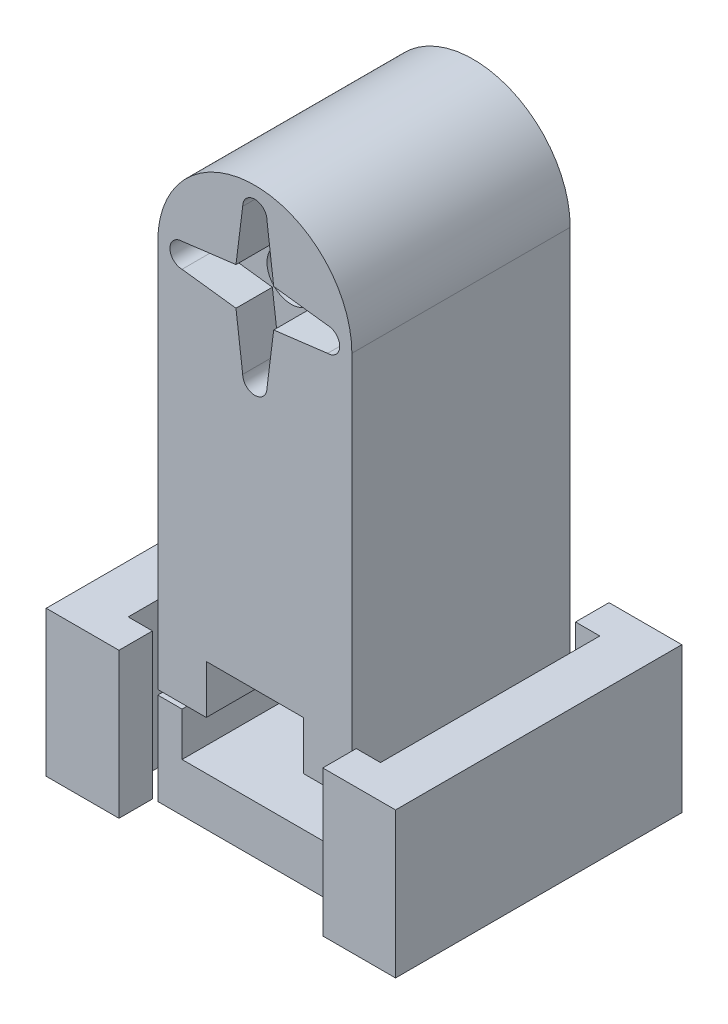
from build123d import *

# Parameters (mm, degrees)
SALIENTE_EXTRUIR1_DEPTH = 45
CORTAR_EXTRUIR1_DEPTH   = 7.5
CROQUIS3_R              = 5
CORTAR_EXTRUIR2_DEPTH   = 57.5
CROQUIS4_W              = 41.868476083
CROQUIS4_H              = 21.001033166
CORTAR_EXTRUIR3_DEPTH   = 57.5
CORTAR_EXTRUIR4_START   = -2.5
CORTAR_EXTRUIR4_DEPTH   = 40
CORTAR_EXTRUIR5_DEPTH   = 45
CORTAR_EXTRUIR7_START   = -40
CROQUIS7_W              = 20
CROQUIS7_H              = 10
CORTAR_EXTRUIR7_DEPTH   = 20
SALIENTE_EXTRUIR2_DEPTH = 45
CROQUIS9_W              = 5
CROQUIS9_H              = 10
CORTAR_EXTRUIR8_DEPTH   = 45
CROQUIS10_R             = 3
CORTAR_EXTRUIR9_DEPTH   = 20
CROQUIS11_W             = 40
CROQUIS11_H             = 1
CORTAR_EXTRUIR12_DEPTH  = 45
CROQUIS12_W             = 5
CROQUIS12_H             = 30
SALIENTE_EXTRUIR3_DEPTH = 7
CROQUIS13_W             = 30
CROQUIS13_H             = 52
SALIENTE_EXTRUIR4_DEPTH = 16
CROQUIS14_W             = 30
CROQUIS14_H             = 52
SALIENTE_EXTRUIR5_DEPTH = 16
CROQUIS15_W             = 6
CROQUIS15_H             = 30
CORTAR_EXTRUIR13_DEPTH  = 7
CROQUIS16_W             = 6
CROQUIS16_H             = 30
CORTAR_EXTRUIR14_DEPTH  = 7
CROQUIS17_W             = 1
CROQUIS17_H             = 30
CORTAR_EXTRUIR15_DEPTH  = 45
CROQUIS18_W             = 15
CROQUIS18_H             = 30
SALIENTE_EXTRUIR6_DEPTH = 7
CORTAR_EXTRUIR16_START  = -6.9
CROQUIS19_W             = 5
CROQUIS19_H             = 30
CORTAR_EXTRUIR16_DEPTH  = 45.2
CORTAR_EXTRUIR17_START  = -6.9
CROQUIS20_W             = 5
CROQUIS20_H             = 30
CORTAR_EXTRUIR17_DEPTH  = 45.2


with BuildPart() as part:
    # Croquis1 → Saliente-Extruir1 (new body)
    with BuildSketch(Plane(origin=(0, 0, 0), x_dir=(0, 1, 0), z_dir=(0, 0, 1))):
        with BuildLine():
            Line((0, 20), (40, 20))
            ThreePointArc((40, 20), (60, 0), (40, -20))
            Line((40, -20), (0, -20))
            Line((0, -20), (-40, -20))
            ThreePointArc((-40, -20), (-60, 0), (-40, 20))
            Line((-40, 20), (0, 20))
        make_face()
    extrude(amount=SALIENTE_EXTRUIR1_DEPTH)

    # Croquis2 → Cortar-Extruir1 (cut)
    with BuildSketch(Plane.XY.offset(45)):
        with BuildLine():
            Line((-15, 42.5), (-3.889087297, 43.889087297))
            Line((-3.889087297, 43.889087297), (-2.5, 55))
            ThreePointArc((-2.5, 55), (0, 57.5), (2.5, 55))
            Line((2.5, 55), (3.889087297, 43.889087297))
            Line((3.889087297, 43.889087297), (15, 42.5))
            ThreePointArc((15, 42.5), (17.5, 40), (15, 37.5))
            Line((15, 37.5), (3.889087297, 36.110912703))
            Line((3.889087297, 36.110912703), (2.5, 25))
            ThreePointArc((2.5, 25), (0, 22.5), (-2.5, 25))
            Line((-2.5, 25), (-3.889087297, 36.110912703))
            Line((-3.889087297, 36.110912703), (-15, 37.5))
            ThreePointArc((-15, 37.5), (-17.5, 40), (-15, 42.5))
        make_face()
    extrude(amount=-CORTAR_EXTRUIR1_DEPTH, mode=Mode.SUBTRACT)

    # Croquis3 → Cortar-Extruir2 (cut)
    with BuildSketch(Plane.XY.offset(45)):
        with Locations((0, 40)):
            Circle(CROQUIS3_R)
    extrude(amount=-CORTAR_EXTRUIR2_DEPTH, mode=Mode.SUBTRACT)

    # Croquis4 → Cortar-Extruir3 (cut)
    with BuildSketch(Plane.XY.offset(45)):
        with Locations((-0.934238042, -50.500516583)):
            Rectangle(CROQUIS4_W, CROQUIS4_H)
    extrude(amount=-CORTAR_EXTRUIR3_DEPTH, mode=Mode.SUBTRACT)

    # Croquis5 → Cortar-Extruir4 (cut)
    with BuildSketch(Plane.XY.offset(45).offset(CORTAR_EXTRUIR4_START)):
        Polygon((0, -40), (10, -40), (10, 0), (-10, 0), (-10, -40), align=None)
    extrude(amount=-CORTAR_EXTRUIR4_DEPTH, mode=Mode.SUBTRACT)

    # Croquis6 → Cortar-Extruir5 (cut)
    with BuildSketch(Plane.XY.offset(45)):
        Polygon((0, -40), (-10, -40), (-10, -30), (10, -30), (10, -40), align=None)
    extrude(amount=-CORTAR_EXTRUIR5_DEPTH, mode=Mode.SUBTRACT)

    # Croquis7 → Cortar-Extruir7 (cut)
    with BuildSketch(Plane.XY.offset(45).offset(CORTAR_EXTRUIR7_START)):
        with Locations((0, -5)):
            Rectangle(CROQUIS7_W, CROQUIS7_H)
    extrude(amount=-CORTAR_EXTRUIR7_DEPTH, mode=Mode.SUBTRACT)

    # Croquis8 → Saliente-Extruir2 (add)
    with BuildSketch(Plane(origin=(0, 0, 0), x_dir=(1, 0, 0), z_dir=(0, 0, -1))):
        Polygon((10, 50), (10, 40), (20, 40), (20, 60), (-20, 60), (-20, 40), (-10, 40), (-10, 50), align=None)
    extrude(amount=-SALIENTE_EXTRUIR2_DEPTH)

    # Croquis9 → Cortar-Extruir8 (cut)
    with BuildSketch(Plane(origin=(0, 0, 0), x_dir=(-1, 0, 0), z_dir=(0, 0, -1))):
        with Locations((-12.5, -45)):
            Rectangle(CROQUIS9_W, CROQUIS9_H)
        with Locations((12.5, -45)):
            Rectangle(CROQUIS9_W, CROQUIS9_H)
    extrude(amount=-CORTAR_EXTRUIR8_DEPTH, mode=Mode.SUBTRACT)

    # Croquis10 → Cortar-Extruir9 (cut)
    with BuildSketch(Plane.XZ.offset(60)):
        with Locations(Location((0, 12.5, 0), (0, 0, 270))):
            Circle(CROQUIS10_R)
    extrude(amount=-CORTAR_EXTRUIR9_DEPTH, mode=Mode.SUBTRACT)

    # Croquis11 → Cortar-Extruir12 (cut)
    with BuildSketch(Plane(origin=(0, 0, 0), x_dir=(1, 0, 0), z_dir=(0, 0, -1))):
        with Locations((0, 40.5)):
            Rectangle(CROQUIS11_W, CROQUIS11_H)
    extrude(amount=-CORTAR_EXTRUIR12_DEPTH, mode=Mode.SUBTRACT)


with BuildPart() as cortar_extruir12_piece_1:
    # of the separate pieces the step leaves, piece 1, a body of its own (cortar_extruir12_pieces)
    add(part.part.solids().sort_by_distance((-20, 40, 0))[0])



with BuildPart() as cortar_extruir12_piece_2:
    # of the separate pieces the step leaves, piece 2, a body of its own (cortar_extruir12_pieces)
    add(part.part.solids().sort_by_distance((-20, -41, 0))[0])


with BuildPart() as cortar_extruir12_piece_1_1:
    add(cortar_extruir12_piece_1.part)

    add(cortar_extruir12_piece_2.part)  # Saliente-Extruir3 merges Cortar-Extruir12 piece 2
    # Croquis12 → Saliente-Extruir3 (add)
    with BuildSketch(Plane.XY.offset(45)):
        with Locations((-17.5, -45)):
            Rectangle(CROQUIS12_W, CROQUIS12_H)
        with Locations((17.5, -45)):
            Rectangle(CROQUIS12_W, CROQUIS12_H)
    extrude(amount=SALIENTE_EXTRUIR3_DEPTH)

    # Croquis13 → Saliente-Extruir4 (add)
    with BuildSketch(Plane.YZ.offset(20)):
        with Locations((-45, 26)):
            Rectangle(CROQUIS13_W, CROQUIS13_H)
    extrude(amount=SALIENTE_EXTRUIR4_DEPTH)

    # Croquis14 → Saliente-Extruir5 (add)
    with BuildSketch(Plane(origin=(-20, 0, 0), x_dir=(0, -1, 0), z_dir=(-1, 0, 0))):
        with Locations((45, 26)):
            Rectangle(CROQUIS14_W, CROQUIS14_H)
    extrude(amount=SALIENTE_EXTRUIR5_DEPTH)

    # Croquis15 → Cortar-Extruir13 (cut)
    with BuildSketch(Plane.XY.offset(52)):
        with Locations((18, -45)):
            Rectangle(CROQUIS15_W, CROQUIS15_H)
    extrude(amount=-CORTAR_EXTRUIR13_DEPTH, mode=Mode.SUBTRACT)

    # Croquis16 → Cortar-Extruir14 (cut)
    with BuildSketch(Plane.XY.offset(52)):
        with Locations((-18, -45)):
            Rectangle(CROQUIS16_W, CROQUIS16_H)
    extrude(amount=-CORTAR_EXTRUIR14_DEPTH, mode=Mode.SUBTRACT)

    # Croquis17 → Cortar-Extruir15 (cut)
    with BuildSketch(Plane.XY.offset(45)):
        with Locations((20.5, -45)):
            Rectangle(CROQUIS17_W, CROQUIS17_H)
        with Locations((-20.5, -45)):
            Rectangle(CROQUIS17_W, CROQUIS17_H)
    extrude(amount=-CORTAR_EXTRUIR15_DEPTH, mode=Mode.SUBTRACT)


with BuildPart() as cortar_extruir15_piece_1:
    # of the separate pieces the step leaves, piece 1, a body of its own (cortar_extruir15_pieces)
    add(cortar_extruir12_piece_1_1.part.solids().sort_by_distance((-20, 40, 0))[0])


with BuildPart() as cortar_extruir15_piece_2:
    # of the separate pieces the step leaves, piece 2, a body of its own (cortar_extruir15_pieces)
    add(cortar_extruir12_piece_1_1.part.solids().sort_by_distance((-21, -30, 52))[0])



with BuildPart() as cortar_extruir15_piece_3:
    # of the separate pieces the step leaves, piece 3, a body of its own (cortar_extruir15_pieces)
    add(cortar_extruir12_piece_1_1.part.solids().sort_by_distance((36, -60, 0))[0])


with BuildPart() as cortar_extruir15_piece_4:
    # of the separate pieces the step leaves, piece 4, a body of its own (cortar_extruir15_pieces)
    add(cortar_extruir12_piece_1_1.part.solids().sort_by_distance((-20, -41, 0))[0])


with BuildPart() as cortar_extruir15_piece_2_1:
    add(cortar_extruir15_piece_2.part)

    add(cortar_extruir15_piece_3.part)  # Saliente-Extruir6 merges Cortar-Extruir15 piece 3
    # Croquis18 → Saliente-Extruir6 (add)
    with BuildSketch(Plane(origin=(0, 0, 0), x_dir=(-1, 0, 0), z_dir=(0, 0, -1))):
        with Locations((28.5, -45)):
            Rectangle(CROQUIS18_W, CROQUIS18_H)
        with Locations((-28.5, -45)):
            Rectangle(CROQUIS18_W, CROQUIS18_H)
    extrude(amount=SALIENTE_EXTRUIR6_DEPTH)

    # Croquis19 → Cortar-Extruir16 (cut)
    with BuildSketch(Plane(origin=(0, 0, -7), x_dir=(-1, 0, 0), z_dir=(0, 0, -1)).offset(CORTAR_EXTRUIR16_START)):
        with Locations((23.5, -45)):
            Rectangle(CROQUIS19_W, CROQUIS19_H)
    extrude(amount=-CORTAR_EXTRUIR16_DEPTH, mode=Mode.SUBTRACT)

    # Croquis20 → Cortar-Extruir17 (cut)
    with BuildSketch(Plane(origin=(0, 0, -7), x_dir=(1, 0, 0), z_dir=(0, 0, -1)).offset(CORTAR_EXTRUIR17_START)):
        with Locations((23.5, 45)):
            Rectangle(CROQUIS20_W, CROQUIS20_H)
    extrude(amount=-CORTAR_EXTRUIR17_DEPTH, mode=Mode.SUBTRACT)


solid = Compound([cortar_extruir15_piece_1.part, cortar_extruir15_piece_4.part, cortar_extruir15_piece_2_1.part])
